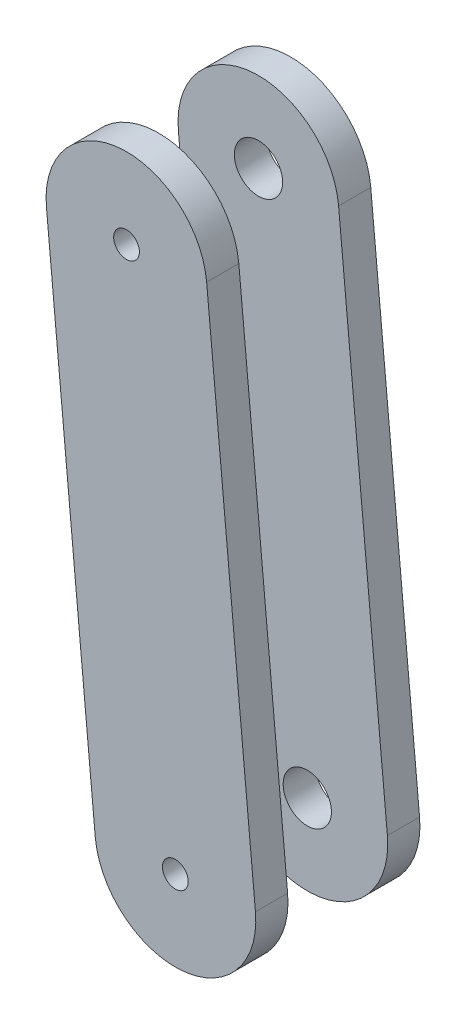
from build123d import *

# Parameters (mm, degrees)
SKETCH_1_R      = 1.6
EXTRUDE_1_DEPTH = 4
SKETCH_3_R      = 3
EXTRUDE_2_DEPTH = 4


with BuildPart() as part:
    # ｽｹｯﾁ1 → ﾎﾞｽ - 押し出し1 (new body)
    with BuildSketch(Plane.XY):
        with BuildLine():
            Line((-26.110299196, 65.672781916), (-20.043619517, 0.932999289))
            ThreePointArc((-20.043619517, 0.932999289), (-29.067000711, -9.956380483), (-39.956380483, -0.932999289))
            Line((-39.956380483, -0.932999289), (-46.023060163, 63.806783338))
            ThreePointArc((-46.023060163, 63.806783338), (-36.999678969, 74.69616311), (-26.110299196, 65.672781916))
        make_face()
        with Locations((-36.06667968, 64.739782627)):
            Circle(SKETCH_1_R, mode=Mode.SUBTRACT)
        with Locations((-30, 0)):
            Circle(SKETCH_1_R, mode=Mode.SUBTRACT)
    extrude(amount=EXTRUDE_1_DEPTH)


with BuildPart() as body_2:
    # ｽｹｯﾁ3 → ﾎﾞｽ - 押し出し2 (new body)
    with BuildSketch(Plane(origin=(0, 0, -12.4), x_dir=(-1, 0, 0), z_dir=(0, 0, -1))):
        with BuildLine():
            Line((26.110299196, 65.672781916), (20.043619517, 0.932999289))
            ThreePointArc((20.043619517, 0.932999289), (29.067000711, -9.956380483), (39.956380483, -0.932999289))
            Line((39.956380483, -0.932999289), (46.023060163, 63.806783338))
            ThreePointArc((46.023060163, 63.806783338), (36.999678969, 74.69616311), (26.110299196, 65.672781916))
        make_face()
        with Locations((30, 0)):
            Circle(SKETCH_3_R, mode=Mode.SUBTRACT)
        with Locations((36.06667968, 64.739782627)):
            Circle(SKETCH_3_R, mode=Mode.SUBTRACT)
    extrude(amount=EXTRUDE_2_DEPTH)


solid = Compound([part.part, body_2.part])
